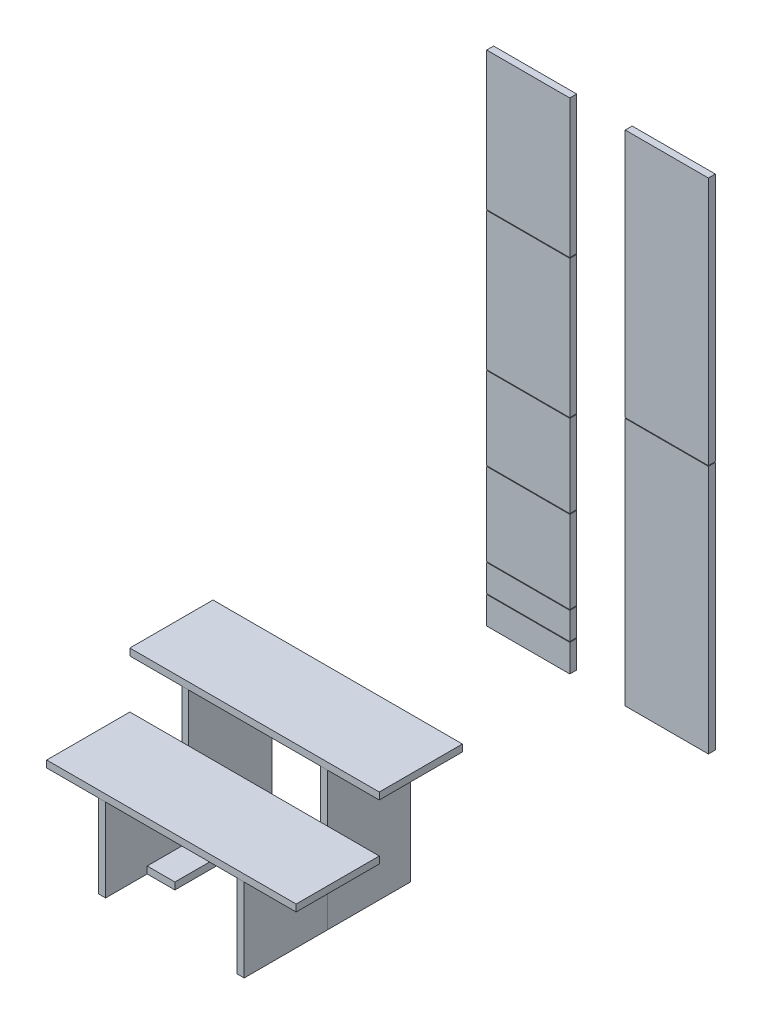
from build123d import *

# Parameters (mm, degrees)
SKETCH1_W               = 25.4
SKETCH1_H               = 304.8
BOSS_EXTRUDE1_DEPTH     = 508
BOSS_EXTRUDE1_2_DEPTH   = 508
SKETCH2_W               = 914.4
SKETCH2_H               = 304.8
BOSS_EXTRUDE2_DEPTH     = 25.4
SKETCH3_W               = 25.4
SKETCH3_H               = 304.8
BOSS_EXTRUDE3_DEPTH     = 304.8
BOSS_EXTRUDE3_2_DEPTH   = 304.8
SKETCH4_W               = 914.4
SKETCH4_H               = 304.8
BOSS_EXTRUDE4_DEPTH     = 25.4
SKETCH5_W               = 304.8
SKETCH5_H               = 25.4
BOSS_EXTRUDE5_DEPTH     = 1828.8
BOSS_EXTRUDE5_2_DEPTH   = 1828.8
BOSS_EXTRUDE6_DEPTH     = 25.4
SKETCH7_W               = 101.6
SKETCH7_H               = 304.8
BOSS_EXTRUDE6_2_DEPTH   = 25.4
SKETCH6_W               = 304.8
SKETCH6_H               = 2.54
CUT_EXTRUDE_THIN1_DEPTH = 25.4


with BuildPart() as part:
    # Sketch1 → Boss-Extrude1 (new body)
    with BuildSketch(Plane(origin=(0, 0, 0), x_dir=(1, 0, 0), z_dir=(0, 1, 0))):
        with Locations((-254, 0)):
            Rectangle(SKETCH1_W, SKETCH1_H)
    extrude(amount=BOSS_EXTRUDE1_DEPTH)


with BuildPart() as body_2:
    # Sketch1 → Boss-Extrude1 2 (new body)
    with BuildSketch(Plane(origin=(0, 0, 0), x_dir=(1, 0, 0), z_dir=(0, 1, 0))):
        with Locations((254, 0)):
            Rectangle(SKETCH1_W, SKETCH1_H)
    extrude(amount=BOSS_EXTRUDE1_2_DEPTH)


with BuildPart() as body_3:
    # Sketch2 → Boss-Extrude2 (new body)
    with BuildSketch(Plane(origin=(0, 508, 0), x_dir=(1, 0, 0), z_dir=(0, 1, 0))):
        Rectangle(SKETCH2_W, SKETCH2_H)
    extrude(amount=BOSS_EXTRUDE2_DEPTH)


with BuildPart() as body_4:
    # Sketch3 → Boss-Extrude3 (new body)
    with BuildSketch(Plane(origin=(0, 0, 0), x_dir=(1, 0, 0), z_dir=(0, 1, 0))):
        with Locations((-254, -304.8)):
            Rectangle(SKETCH3_W, SKETCH3_H)
    extrude(amount=BOSS_EXTRUDE3_DEPTH)


with BuildPart() as body_5:
    # Sketch3 → Boss-Extrude3 2 (new body)
    with BuildSketch(Plane(origin=(0, 0, 0), x_dir=(1, 0, 0), z_dir=(0, 1, 0))):
        with Locations((254, -304.8)):
            Rectangle(SKETCH3_W, SKETCH3_H)
    extrude(amount=BOSS_EXTRUDE3_2_DEPTH)


with BuildPart() as body_6:
    # Sketch4 → Boss-Extrude4 (new body)
    with BuildSketch(Plane(origin=(0, 304.8, 0), x_dir=(1, 0, 0), z_dir=(0, 1, 0))):
        with Locations((0, -304.8)):
            Rectangle(SKETCH4_W, SKETCH4_H)
    extrude(amount=BOSS_EXTRUDE4_DEPTH)


with BuildPart() as body_7:
    # Sketch5 → Boss-Extrude5 (new body)
    with BuildSketch(Plane(origin=(0, 0, 0), x_dir=(1, 0, 0), z_dir=(0, 1, 0))):
        with Locations((-254, 1117.6)):
            Rectangle(SKETCH5_W, SKETCH5_H)
    extrude(amount=BOSS_EXTRUDE5_DEPTH)


with BuildPart() as body_8:
    # Sketch5 → Boss-Extrude5 2 (new body)
    with BuildSketch(Plane(origin=(0, 0, 0), x_dir=(1, 0, 0), z_dir=(0, 1, 0))):
        with Locations((254, 1117.6)):
            Rectangle(SKETCH5_W, SKETCH5_H)
    extrude(amount=BOSS_EXTRUDE5_2_DEPTH)


with BuildPart() as body_9:
    # Sketch7 → Boss-Extrude6 (new body)
    with BuildSketch(Plane.XZ):
        Polygon((-139.7, 304.8), (-241.3, 304.8), (-241.3, 152.4), (-241.3, 0), (-139.7, 0), align=None)
    extrude(amount=-BOSS_EXTRUDE6_DEPTH)


with BuildPart() as body_10:
    # Sketch7 → Boss-Extrude6 2 (new body)
    with BuildSketch(Plane.XZ):
        with Locations((190.5, 152.4)):
            Rectangle(SKETCH7_W, SKETCH7_H)
    extrude(amount=-BOSS_EXTRUDE6_2_DEPTH)


with BuildPart() as cut_extrude_thin1_tool:
    # Sketch6 → Cut-Extrude-Thin1 (new body)
    with BuildSketch(Plane(origin=(0, 0, -1130.3), x_dir=(-1, 0, 0), z_dir=(0, 0, -1))):
        with Locations((-254, 914.4)):
            Rectangle(SKETCH6_W, SKETCH6_H)
        with Locations((254, 1320.8)):
            Rectangle(SKETCH6_W, SKETCH6_H)
        with Locations((254, 812.8)):
            Rectangle(SKETCH6_W, SKETCH6_H)
        with Locations((254, 508)):
            Rectangle(SKETCH6_W, SKETCH6_H)
        with Locations((254, 203.2)):
            Rectangle(SKETCH6_W, SKETCH6_H)
        with Locations((254, 101.6)):
            Rectangle(SKETCH6_W, SKETCH6_H)
    extrude(amount=-CUT_EXTRUDE_THIN1_DEPTH)


with BuildPart() as body_7_1:
    add(body_7.part)

    # Cut-Extrude-Thin1: cut by cut_extrude_thin1_tool
    add(cut_extrude_thin1_tool.part, mode=Mode.SUBTRACT)


with BuildPart() as body_8_1:
    add(body_8.part)

    # Cut-Extrude-Thin1: cut by cut_extrude_thin1_tool
    add(cut_extrude_thin1_tool.part, mode=Mode.SUBTRACT)


with BuildPart() as cut_extrude_thin1_piece_1:
    # of the separate pieces the step leaves, piece 1, a body of its own (cut_extrude_thin1_pieces)
    add(body_7_1.part.solids().sort_by_distance((-406.4, 1322.07, -1130.3))[0])


with BuildPart() as cut_extrude_thin1_piece_2:
    # of the separate pieces the step leaves, piece 2, a body of its own (cut_extrude_thin1_pieces)
    add(body_7_1.part.solids().sort_by_distance((-406.4, 814.07, -1130.3))[0])


with BuildPart() as cut_extrude_thin1_piece_3:
    # of the separate pieces the step leaves, piece 3, a body of its own (cut_extrude_thin1_pieces)
    add(body_7_1.part.solids().sort_by_distance((-406.4, 204.47, -1130.3))[0])


with BuildPart() as cut_extrude_thin1_piece_4:
    # of the separate pieces the step leaves, piece 4, a body of its own (cut_extrude_thin1_pieces)
    add(body_7_1.part.solids().sort_by_distance((-406.4, 509.27, -1130.3))[0])


with BuildPart() as cut_extrude_thin1_piece_5:
    # of the separate pieces the step leaves, piece 5, a body of its own (cut_extrude_thin1_pieces)
    add(body_7_1.part.solids().sort_by_distance((-406.4, 0, -1130.3))[0])


with BuildPart() as cut_extrude_thin1_piece_6:
    # of the separate pieces the step leaves, piece 6, a body of its own (cut_extrude_thin1_pieces)
    add(body_7_1.part.solids().sort_by_distance((-406.4, 102.87, -1130.3))[0])


with BuildPart() as cut_extrude_thin1_piece_1_of_body_8:
    # of the separate pieces the step leaves, piece 1, a body of its own (cut_extrude_thin1_pieces_of_body_8)
    add(body_8_1.part.solids().sort_by_distance((101.6, 0, -1130.3))[0])


with BuildPart() as cut_extrude_thin1_piece_2_of_body_8:
    # of the separate pieces the step leaves, piece 2, a body of its own (cut_extrude_thin1_pieces_of_body_8)
    add(body_8_1.part.solids().sort_by_distance((101.6, 915.67, -1130.3))[0])


solid = Compound([part.part, body_2.part, body_3.part, body_4.part, body_5.part, body_6.part, body_9.part, body_10.part, cut_extrude_thin1_piece_1.part, cut_extrude_thin1_piece_2.part, cut_extrude_thin1_piece_3.part, cut_extrude_thin1_piece_4.part, cut_extrude_thin1_piece_5.part, cut_extrude_thin1_piece_6.part, cut_extrude_thin1_piece_1_of_body_8.part, cut_extrude_thin1_piece_2_of_body_8.part])
